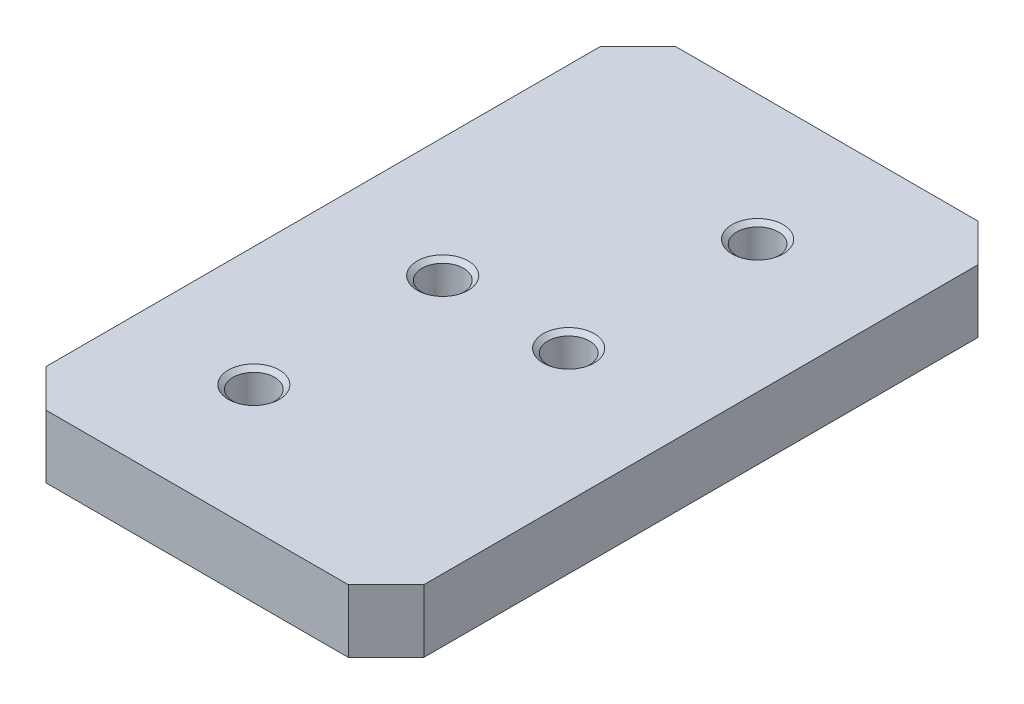
from build123d import *

# Parameters (mm, degrees)
SKETCH1_W                       = 30
SKETCH1_H                       = 50
BOSS_EXTRUDE1_DEPTH             = 5
M4X0_7_TAPPED_HOLE1_D           = 3.3
M4X0_7_TAPPED_HOLE1_CSINK_D     = 4.05
M4X0_7_TAPPED_HOLE1_CSINK_ANGLE = 100
CHAMFER1_SIZE                   = 3


with BuildPart() as part:
    # Sketch1 → Boss-Extrude1 (new body)
    with BuildSketch(Plane(origin=(0, 0, 0), x_dir=(1, 0, 0), z_dir=(0, 1, 0))):
        Rectangle(SKETCH1_W, SKETCH1_H)
    extrude(amount=BOSS_EXTRUDE1_DEPTH)

    # M4x0.7 Tapped Hole1 (through all)
    with Locations(Plane(origin=(0, 5, 0), x_dir=(1, 0, 0), z_dir=(0, 1, 0))):
        with Locations((-5.5, -15), (-5.5, 0), (4.5, 0), (4.5, 15)):
            CounterSinkHole(M4X0_7_TAPPED_HOLE1_D / 2, M4X0_7_TAPPED_HOLE1_CSINK_D / 2, counter_sink_angle=M4X0_7_TAPPED_HOLE1_CSINK_ANGLE)

    # Chamfer1
    chamfer1_edges = [part.edges().sort_by_distance(p)[0] for p in [
        (15, 2.5, 25),
        (-15, 2.5, 25),
        (-15, 2.5, -25),
        (15, 2.5, -25),
    ]]
    chamfer(chamfer1_edges, length=CHAMFER1_SIZE)


solid = part.part
